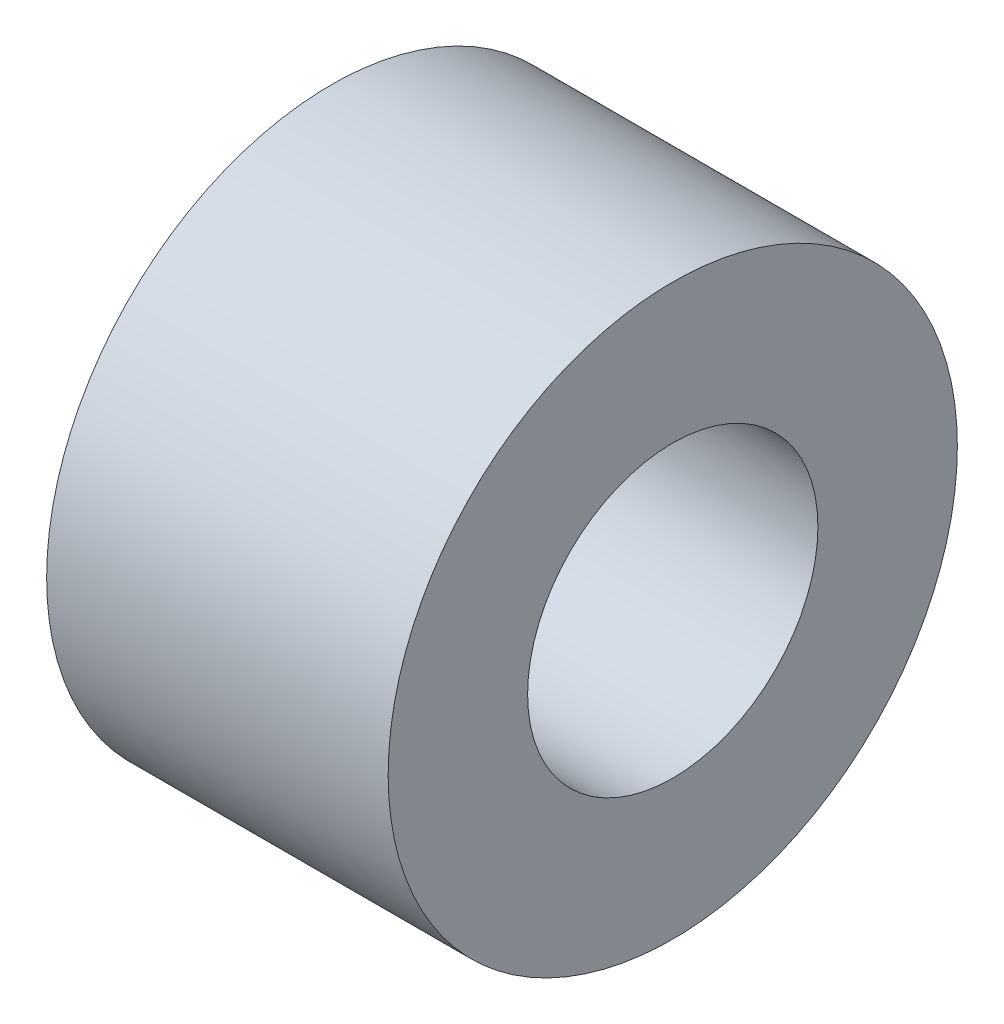
from build123d import *

# Parameters (mm, degrees)
SKETCH1_R           = 6.35
SKETCH1_R_2         = 3.2385
BOSS_EXTRUDE1_DEPTH = 7.62


with BuildPart() as part:
    # Sketch1 → Boss-Extrude1 (new body)
    with BuildSketch(Plane(origin=(0, 0, 0), x_dir=(0, 0, -1), z_dir=(1, 0, 0))):
        with Locations(Location((0, 0, 0), (0, 0, 180))):
            Circle(SKETCH1_R)
        with Locations(Location((0, 0, 0), (0, 0, 180))):
            Circle(SKETCH1_R_2, mode=Mode.SUBTRACT)
    extrude(amount=BOSS_EXTRUDE1_DEPTH)


solid = part.part
